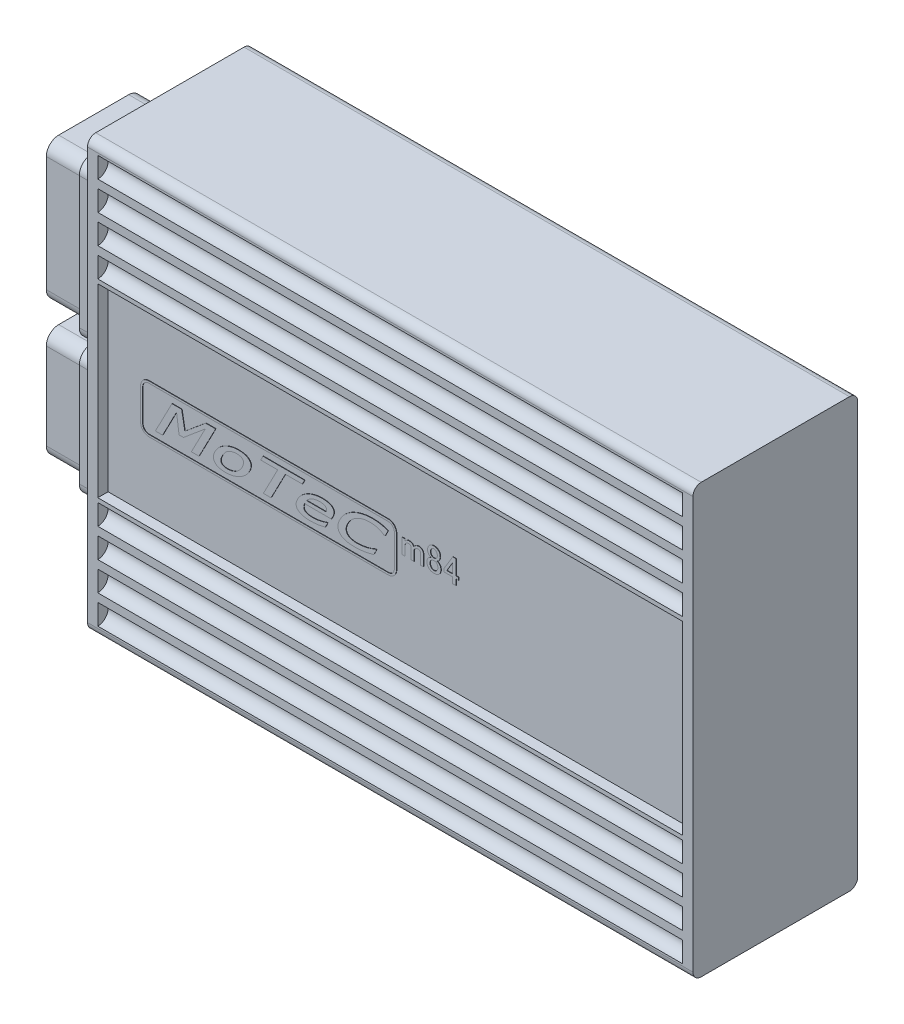
from build123d import *

# Parameters (mm, degrees)
SKETCH_1_W          = 147
SKETCH_1_H          = 104
EXTRUDE_1_DEPTH     = 40
FILLET_1_R          = 2
SKETCH_5_W          = 147
SKETCH_5_H          = 45
CUT_EXTRUDE_1_DEPTH = 2.5
CUT_EXTRUDE_2_DEPTH = 161.975153362
SKETCH_7_W          = 147
SKETCH_7_H          = 45
CUT_EXTRUDE_3_DEPTH = 2.5
EXTRUDE_4_DEPTH     = 2.5
EXTRUDE_5_DEPTH     = 2.5
EXTRUDE_6_DEPTH     = 0.1
EXTRUDE_7_DEPTH     = 0.1
SKETCH_13_W         = 27
SKETCH_13_H         = 38
SKETCH_13_H_2       = 31
EXTRUDE_8_DEPTH     = 8
SKETCH_14_W         = 23
SKETCH_14_H         = 34
SKETCH_14_H_2       = 27
EXTRUDE_9_DEPTH     = 10
FILLET_2_R          = 3
SKETCH_15_R         = 8.844335161
SKETCH_15_R_2       = 8.721679786
CUT_EXTRUDE_4_DEPTH = 1


with BuildPart() as part:
    # ｽｹｯﾁ1 → ﾎﾞｽ - 押し出し1 (new body)
    with BuildSketch(Plane.XY):
        Rectangle(SKETCH_1_W, SKETCH_1_H)
    extrude(amount=EXTRUDE_1_DEPTH)

    # ﾌｨﾚｯﾄ1
    fillet_1_edges = [part.edges().sort_by_distance(p)[0] for p in [
        (0, -52, 40),
        (0, -52, 0),
        (0, 52, 0),
        (0, 52, 40),
    ]]
    fillet(fillet_1_edges, radius=FILLET_1_R)

    # ｽｹｯﾁ5 → ｶｯﾄ - 押し出し1 (cut)
    with BuildSketch(Plane(origin=(0, 0, 0), x_dir=(-1, 0, 0), z_dir=(0, 0, -1))):
        Rectangle(SKETCH_5_W, SKETCH_5_H)
    extrude(amount=-CUT_EXTRUDE_1_DEPTH, mode=Mode.SUBTRACT)

    # ｽｹｯﾁ6 → ｶｯﾄ - 押し出し2 (cut, through all)
    with BuildSketch(Plane.ZY.offset(73.5)):
        with BuildLine():
            Line((0, 49.5), (0, 44.5))
            ThreePointArc((0, 44.5), (2.5, 47), (0, 49.5))
        make_face()
        with BuildLine():
            Line((0, 42.5), (0, 37.5))
            ThreePointArc((0, 37.5), (2.5, 40), (0, 42.5))
        make_face()
        with BuildLine():
            Line((0, 35.5), (0, 30.5))
            ThreePointArc((0, 30.5), (2.5, 33), (0, 35.5))
        make_face()
        with BuildLine():
            Line((0, 28.5), (0, 23.5))
            ThreePointArc((0, 23.5), (2.5, 26), (0, 28.5))
        make_face()
        with BuildLine():
            Line((40, 28.5), (40, 23.5))
            ThreePointArc((40, 23.5), (37.5, 26), (40, 28.5))
        make_face()
        with BuildLine():
            Line((40, 35.5), (40, 30.5))
            ThreePointArc((40, 30.5), (37.5, 33), (40, 35.5))
        make_face()
        with BuildLine():
            Line((40, 42.5), (40, 37.5))
            ThreePointArc((40, 37.5), (37.5, 40), (40, 42.5))
        make_face()
        with BuildLine():
            Line((40, 49.5), (40, 44.5))
            ThreePointArc((40, 44.5), (37.5, 47), (40, 49.5))
        make_face()
    cut_extrude_2 = extrude(amount=-CUT_EXTRUDE_2_DEPTH, mode=Mode.SUBTRACT)

    # ﾐﾗｰ1: ｶｯﾄ - 押し出し2 across plane
    add(cut_extrude_2.mirror(Plane.ZX), mode=Mode.SUBTRACT)

    # ｽｹｯﾁ7 → ｶｯﾄ - 押し出し3 (cut)
    with BuildSketch(Plane.XY.offset(40)):
        Rectangle(SKETCH_7_W, SKETCH_7_H)
    extrude(amount=-CUT_EXTRUDE_3_DEPTH, mode=Mode.SUBTRACT)

    # ｽｹｯﾁ8 → ﾎﾞｽ - 押し出し4 (add)
    with BuildSketch(Plane.ZY.offset(73.5)):
        with BuildLine():
            Line((2, -52), (38, -52))
            ThreePointArc((38, -52), (39.414213562, -51.414213562), (40, -50))
            Line((40, -50), (40, 50))
            ThreePointArc((40, 50), (39.414213562, 51.414213562), (38, 52))
            Line((38, 52), (2, 52))
            ThreePointArc((2, 52), (0.585786438, 51.414213562), (0, 50))
            Line((0, 50), (0, -50))
            ThreePointArc((0, -50), (0.585786438, -51.414213562), (2, -52))
        make_face()
    extrude(amount=-EXTRUDE_4_DEPTH)

    # ｽｹｯﾁ9 → ﾎﾞｽ - 押し出し5 (add)
    with BuildSketch(Plane(origin=(73.5, 0, 0), x_dir=(0, 0, -1), z_dir=(1, 0, 0))):
        with BuildLine():
            Line((-38, -52), (-2, -52))
            ThreePointArc((-2, -52), (-0.585786438, -51.414213562), (0, -50))
            Line((0, -50), (0, 50))
            ThreePointArc((0, 50), (-0.585786438, 51.414213562), (-2, 52))
            Line((-2, 52), (-38, 52))
            ThreePointArc((-38, 52), (-39.414213562, 51.414213562), (-40, 50))
            Line((-40, 50), (-40, -50))
            ThreePointArc((-40, -50), (-39.414213562, -51.414213562), (-38, -52))
        make_face()
    extrude(amount=-EXTRUDE_5_DEPTH)

    # ｽｹｯﾁ11 → ﾎﾞｽ - 押し出し6 (add)
    # profile 1 of 3: a face of its own
    with BuildSketch(Plane.XY.offset(37.5)):
        with BuildLine():
            Line((1.144144144, 0.098069498), (0.447971781, 0.098069498))
            Line((0.447971781, 0.098069498), (0.447971781, 3.759330759))
            Line((0.447971781, 3.759330759), (1.144144144, 3.759330759))
            Line((1.144144144, 3.759330759), (1.144144144, 3.203603604))
            add(Edge.make_bspline(
                [(1.144144144, 3.203603604), (1.209094475, 3.300576984), (1.316490685, 3.432401394), (1.476128806, 3.58323051), (1.598188132, 3.67094831), (1.723684656, 3.739797755), (1.896496282, 3.805448376), (2.033643976, 3.824764595), (2.124839125, 3.824710425)],
                knots=[0, 0, 0, 0, 0.289076243, 0.420055779, 0.543346146, 0.660648957, 0.774006625, 1, 1, 1, 1], degree=3))
            add(Edge.make_bspline(
                [(2.124839125, 3.824710425), (2.222453162, 3.825502434), (2.365318527, 3.815397975), (2.547538805, 3.781292301), (2.671391328, 3.746176063), (2.785948421, 3.70006945), (2.925267534, 3.624888497), (3.018307002, 3.552522146), (3.072844273, 3.497812098)],
                knots=[0, 0, 0, 0, 0.284349585, 0.416050932, 0.539630879, 0.658870528, 0.775162342, 1, 1, 1, 1], degree=3))
            add(Edge.make_bspline(
                [(3.072844273, 3.497812098), (3.125910433, 3.444067838), (3.2249881, 3.332056492), (3.300695747, 3.203147761), (3.334362934, 3.138223938)],
                knots=[0, 0, 0, 0, 0.508065967, 1, 1, 1, 1], degree=3))
            add(Edge.make_bspline(
                [(3.334362934, 3.138223938), (3.400916793, 3.246117725), (3.514183942, 3.39515933), (3.69458124, 3.559539674), (3.839074417, 3.655319927), (3.992148203, 3.731705924), (4.213801324, 3.806649249), (4.391790494, 3.823489453), (4.511196911, 3.824710425)],
                knots=[0, 0, 0, 0, 0.26615625, 0.390354004, 0.51067604, 0.62890337, 0.748675196, 1, 1, 1, 1], degree=3))
            add(Edge.make_bspline(
                [(4.511196911, 3.824710425), (4.593711478, 3.823900393), (4.714964686, 3.817132519), (4.870108538, 3.785588746), (4.976339715, 3.753121766), (5.075851443, 3.711588521), (5.198084993, 3.644276204), (5.279657693, 3.578954386), (5.328442728, 3.530501931)],
                knots=[0, 0, 0, 0, 0.277853537, 0.406705624, 0.531658906, 0.650907513, 0.768780622, 1, 1, 1, 1], degree=3))
            add(Edge.make_bspline(
                [(5.328442728, 3.530501931), (5.38029412, 3.478665866), (5.451324968, 3.396653054), (5.528818936, 3.278355141), (5.576015875, 3.189084536), (5.610296883, 3.097212137), (5.645373484, 2.97259854), (5.655816367, 2.875985595), (5.655341055, 2.811325611)],
                knots=[0, 0, 0, 0, 0.271080785, 0.399344613, 0.522112387, 0.643458092, 0.761078932, 1, 1, 1, 1], degree=3))
            Line((5.655341055, 2.811325611), (5.655341055, 0.098069498))
            Line((5.655341055, 0.098069498), (4.959168693, 0.098069498))
            Line((4.959168693, 0.098069498), (4.959168693, 2.680566281))
            add(Edge.make_bspline(
                [(4.959168693, 2.680566281), (4.957533627, 2.740900528), (4.948967941, 2.856801651), (4.900941368, 2.962851102), (4.870785071, 3.007464607)],
                knots=[0, 0, 0, 0, 0.52989765, 1, 1, 1, 1], degree=3))
            add(Edge.make_bspline(
                [(4.870785071, 3.007464607), (4.810022588, 3.068517718), (4.669054485, 3.172179641), (4.496902642, 3.203775177), (4.413127413, 3.203603604)],
                knots=[0, 0, 0, 0, 0.507505966, 1, 1, 1, 1], degree=3))
            add(Edge.make_bspline(
                [(4.413127413, 3.203603604), (4.339831937, 3.202789794), (4.231484319, 3.195531115), (4.092740614, 3.164650864), (3.996262969, 3.130974916), (3.903905229, 3.090652477), (3.78820347, 3.021145215), (3.708921056, 2.957782376), (3.661261261, 2.909395109)],
                knots=[0, 0, 0, 0, 0.265314778, 0.391024086, 0.512886475, 0.634416216, 0.754827548, 1, 1, 1, 1], degree=3))
            add(Edge.make_bspline(
                [(3.661261261, 2.909395109), (3.587585708, 2.832970405), (3.459302835, 2.687846458), (3.401078827, 2.502381341), (3.3997426, 2.419047619)],
                knots=[0, 0, 0, 0, 0.564258034, 1, 1, 1, 1], degree=3))
            Line((3.3997426, 2.419047619), (3.3997426, 0.098069498))
            Line((3.3997426, 0.098069498), (2.703570237, 0.098069498))
            Line((2.703570237, 0.098069498), (2.703570237, 2.647876448))
            add(Edge.make_bspline(
                [(2.703570237, 2.647876448), (2.704140297, 2.715262391), (2.672005479, 2.85675132), (2.597820466, 2.981137348), (2.54980695, 3.04015444)],
                knots=[0, 0, 0, 0, 0.46824483, 1, 1, 1, 1], degree=3))
            add(Edge.make_bspline(
                [(2.54980695, 3.04015444), (2.493149542, 3.098007569), (2.334298815, 3.183611446), (2.155918243, 3.205201222), (2.059459459, 3.203603604)],
                knots=[0, 0, 0, 0, 0.453090255, 1, 1, 1, 1], degree=3))
            add(Edge.make_bspline(
                [(2.059459459, 3.203603604), (1.944729086, 3.205380493), (1.713210608, 3.159757499), (1.519279466, 3.025504849), (1.438352638, 2.942084942)],
                knots=[0, 0, 0, 0, 0.496525804, 1, 1, 1, 1], degree=3))
            add(Edge.make_bspline(
                [(1.438352638, 2.942084942), (1.35447241, 2.856242051), (1.212714539, 2.690331933), (1.143236289, 2.48177415), (1.144144144, 2.386357786)],
                knots=[0, 0, 0, 0, 0.561835364, 1, 1, 1, 1], degree=3))
            Line((1.144144144, 2.386357786), (1.144144144, 0.098069498))
        make_face()
    # profile 2 of 3: a face of its own
    with BuildSketch(Plane.XY.offset(37.5)):
        with BuildLine():
            Line((8.965489299, 3.007464607), (8.965489299, 2.942084942))
            add(Edge.make_bspline(
                [(8.965489299, 2.942084942), (9.066135435, 2.919951937), (9.27023082, 2.836416684), (9.439678289, 2.695712893), (9.521216455, 2.615186615)],
                knots=[0, 0, 0, 0, 0.472373328, 1, 1, 1, 1], degree=3))
            add(Edge.make_bspline(
                [(9.521216455, 2.615186615), (9.585452655, 2.550762147), (9.6733995, 2.444937025), (9.76191299, 2.284723735), (9.818308984, 2.157849235), (9.860034277, 2.021864576), (9.903959162, 1.826621272), (9.912857116, 1.673056413), (9.913494447, 1.569111969)],
                knots=[0, 0, 0, 0, 0.238093942, 0.356647629, 0.47758062, 0.60036302, 0.727832734, 1, 1, 1, 1], degree=3))
            add(Edge.make_bspline(
                [(9.913494447, 1.569111969), (9.913786048, 1.46355969), (9.899227581, 1.307421444), (9.852036974, 1.106434786), (9.802098975, 0.963401973), (9.736512725, 0.826947911), (9.629417916, 0.651184491), (9.53064566, 0.530730209), (9.455836789, 0.457657658)],
                knots=[0, 0, 0, 0, 0.256257606, 0.379192059, 0.500730937, 0.623508935, 0.746243874, 1, 1, 1, 1], degree=3))
            add(Edge.make_bspline(
                [(9.455836789, 0.457657658), (9.383864278, 0.387220625), (9.263851695, 0.291320196), (9.081262489, 0.195153101), (8.931205386, 0.136211677), (8.769402856, 0.088125697), (8.529433762, 0.045329772), (8.342131055, 0.030730599), (8.213623147, 0.032689833)],
                knots=[0, 0, 0, 0, 0.224285237, 0.339223886, 0.458168827, 0.582682974, 0.714302543, 1, 1, 1, 1], degree=3))
            add(Edge.make_bspline(
                [(8.213623147, 0.032689833), (8.085115239, 0.030730599), (7.897812532, 0.045329772), (7.657843437, 0.088125697), (7.496040908, 0.136211677), (7.345983804, 0.195153101), (7.163394599, 0.291320196), (7.043382016, 0.387220625), (6.971409505, 0.457657658)],
                knots=[0, 0, 0, 0, 0.285697457, 0.417317026, 0.541831173, 0.660776114, 0.775714763, 1, 1, 1, 1], degree=3))
            add(Edge.make_bspline(
                [(6.971409505, 0.457657658), (6.896430141, 0.530653978), (6.798155259, 0.651330647), (6.690351192, 0.826589026), (6.626994804, 0.963996337), (6.574754581, 1.106119498), (6.528357976, 1.307549811), (6.51328421, 1.463493083), (6.513751847, 1.569111969)],
                knots=[0, 0, 0, 0, 0.253779418, 0.376525622, 0.498895351, 0.620773136, 0.743718873, 1, 1, 1, 1], degree=3))
            add(Edge.make_bspline(
                [(6.513751847, 1.569111969), (6.514389178, 1.673056413), (6.523287132, 1.826621272), (6.567212017, 2.021864576), (6.60893731, 2.157849235), (6.665333304, 2.284723735), (6.753846794, 2.444937025), (6.841793639, 2.550762147), (6.906029839, 2.615186615)],
                knots=[0, 0, 0, 0, 0.272167266, 0.39963698, 0.52241938, 0.643352371, 0.761906058, 1, 1, 1, 1], degree=3))
            add(Edge.make_bspline(
                [(6.906029839, 2.615186615), (6.987568005, 2.695712893), (7.157015473, 2.836416684), (7.361110858, 2.919951937), (7.461756995, 2.942084942)],
                knots=[0, 0, 0, 0, 0.527626672, 1, 1, 1, 1], degree=3))
            Line((7.461756995, 2.942084942), (7.461756995, 3.007464607))
            add(Edge.make_bspline(
                [(7.461756995, 3.007464607), (7.387744142, 3.03094171), (7.236053687, 3.118292426), (7.105188692, 3.23352326), (7.03678917, 3.301673102)],
                knots=[0, 0, 0, 0, 0.444019688, 1, 1, 1, 1], degree=3))
            add(Edge.make_bspline(
                [(7.03678917, 3.301673102), (6.977518997, 3.35903046), (6.899662198, 3.454339857), (6.816093373, 3.593494288), (6.764652133, 3.701531415), (6.726085184, 3.815029485), (6.688063226, 3.975123666), (6.677701886, 4.09996308), (6.677201011, 4.184298584)],
                knots=[0, 0, 0, 0, 0.252388127, 0.374950703, 0.496630733, 0.618235357, 0.741494458, 1, 1, 1, 1], degree=3))
            add(Edge.make_bspline(
                [(6.677201011, 4.184298584), (6.676788162, 4.299513212), (6.691239733, 4.468775711), (6.738116282, 4.686684342), (6.789602145, 4.838044846), (6.853929919, 4.982268437), (6.959522519, 5.16413109), (7.05983462, 5.286997589), (7.134858668, 5.361132561)],
                knots=[0, 0, 0, 0, 0.266281071, 0.391515052, 0.514598345, 0.63533766, 0.756206788, 1, 1, 1, 1], degree=3))
            add(Edge.make_bspline(
                [(7.134858668, 5.361132561), (7.200211428, 5.425268726), (7.30730912, 5.513878349), (7.470524842, 5.602074303), (7.601082347, 5.658438456), (7.741930041, 5.700087781), (7.945320215, 5.743870165), (8.105241661, 5.752847284), (8.213623147, 5.753410553)],
                knots=[0, 0, 0, 0, 0.23339933, 0.350616063, 0.471182202, 0.594644589, 0.723765921, 1, 1, 1, 1], degree=3))
            add(Edge.make_bspline(
                [(8.213623147, 5.753410553), (8.323233931, 5.755112588), (8.48410633, 5.740416863), (8.691239122, 5.697387161), (8.834442306, 5.649365619), (8.970079151, 5.589872982), (9.141204679, 5.492779169), (9.254873969, 5.397392466), (9.325077458, 5.328442728)],
                knots=[0, 0, 0, 0, 0.268572808, 0.395225723, 0.51830846, 0.638475842, 0.758246691, 1, 1, 1, 1], degree=3))
            add(Edge.make_bspline(
                [(9.325077458, 5.328442728), (9.39418836, 5.257454785), (9.489224205, 5.142369257), (9.587427387, 4.968978387), (9.645880312, 4.829182396), (9.694048753, 4.68123385), (9.737365049, 4.466040863), (9.751796352, 4.298723305), (9.750045283, 4.184298584)],
                knots=[0, 0, 0, 0, 0.237237054, 0.354867339, 0.475588846, 0.599282908, 0.726563048, 1, 1, 1, 1], degree=3))
            add(Edge.make_bspline(
                [(9.750045283, 4.184298584), (9.74955551, 4.094804049), (9.739885167, 3.96123048), (9.696079163, 3.790830625), (9.654422111, 3.668504224), (9.597576308, 3.552468455), (9.508437451, 3.400715898), (9.420381221, 3.299951892), (9.357767291, 3.236293436)],
                knots=[0, 0, 0, 0, 0.255143643, 0.378267329, 0.499952309, 0.622215881, 0.745323495, 1, 1, 1, 1], degree=3))
            add(Edge.make_bspline(
                [(9.357767291, 3.236293436), (9.303144089, 3.184136782), (9.1835047, 3.085887304), (9.039239837, 3.029434866), (8.965489299, 3.007464607)],
                knots=[0, 0, 0, 0, 0.495336252, 1, 1, 1, 1], degree=3))
        make_face()
        with BuildLine():
            add(Edge.make_bspline(
                [(8.213623147, 5.164993565), (8.110867842, 5.164521396), (7.902597168, 5.130227617), (7.730163677, 5.008392673), (7.657895991, 4.936164736)],
                knots=[0, 0, 0, 0, 0.501620805, 1, 1, 1, 1], degree=3))
            add(Edge.make_bspline(
                [(7.657895991, 4.936164736), (7.612808635, 4.893560551), (7.557725294, 4.817587027), (7.49589241, 4.707898191), (7.459876828, 4.616407695), (7.430321328, 4.518987394), (7.405393845, 4.374142701), (7.394301605, 4.261879997), (7.39637733, 4.184298584)],
                knots=[0, 0, 0, 0, 0.226301537, 0.34299475, 0.461284975, 0.586435464, 0.716022688, 1, 1, 1, 1], degree=3))
            add(Edge.make_bspline(
                [(7.39637733, 4.184298584), (7.394045852, 4.111473652), (7.405887536, 4.005797818), (7.430016881, 3.869220684), (7.460596729, 3.776587561), (7.495856135, 3.688474606), (7.558042733, 3.581346623), (7.613986156, 3.507790863), (7.657895991, 3.465122265)],
                knots=[0, 0, 0, 0, 0.276895612, 0.405600582, 0.52837923, 0.648539863, 0.767199981, 1, 1, 1, 1], degree=3))
            add(Edge.make_bspline(
                [(7.657895991, 3.465122265), (7.728278551, 3.393840982), (7.889922669, 3.275872131), (8.086037652, 3.236181018), (8.180933314, 3.236293436)],
                knots=[0, 0, 0, 0, 0.514332654, 1, 1, 1, 1], degree=3))
            add(Edge.make_bspline(
                [(8.180933314, 3.236293436), (8.296842029, 3.235588362), (8.511158166, 3.259952083), (8.701882786, 3.362895066), (8.769350303, 3.432432432)],
                knots=[0, 0, 0, 0, 0.548332788, 1, 1, 1, 1], degree=3))
            add(Edge.make_bspline(
                [(8.769350303, 3.432432432), (8.813378155, 3.475979123), (8.871724326, 3.549944449), (8.930988181, 3.661115321), (8.967607122, 3.752101519), (8.99642492, 3.849788595), (9.024738233, 3.994040256), (9.031056052, 4.107031508), (9.030868964, 4.184298584)],
                knots=[0, 0, 0, 0, 0.227087098, 0.343044258, 0.461305242, 0.586424794, 0.716259043, 1, 1, 1, 1], degree=3))
            add(Edge.make_bspline(
                [(9.030868964, 4.184298584), (9.031056052, 4.26156566), (9.024738233, 4.374556912), (8.99642492, 4.518808574), (8.967607122, 4.61649565), (8.930988181, 4.707481847), (8.871724326, 4.818652719), (8.813378155, 4.892618046), (8.769350303, 4.936164736)],
                knots=[0, 0, 0, 0, 0.283740957, 0.413575206, 0.538694758, 0.656955742, 0.772912902, 1, 1, 1, 1], degree=3))
            add(Edge.make_bspline(
                [(8.769350303, 4.936164736), (8.697082617, 5.008392673), (8.524649126, 5.130227617), (8.316378452, 5.164521396), (8.213623147, 5.164993565)],
                knots=[0, 0, 0, 0, 0.498379195, 1, 1, 1, 1], degree=3))
        make_face(mode=Mode.SUBTRACT)
        with BuildLine():
            add(Edge.make_bspline(
                [(8.213623147, 2.680566281), (8.145962429, 2.681046709), (8.046278765, 2.673920041), (7.918540086, 2.646066966), (7.829961199, 2.616636254), (7.745712521, 2.580447266), (7.640074156, 2.520541136), (7.569862076, 2.46197437), (7.52713666, 2.419047619)],
                knots=[0, 0, 0, 0, 0.268893381, 0.395354554, 0.518591747, 0.639255943, 0.759203962, 1, 1, 1, 1], degree=3))
            add(Edge.make_bspline(
                [(7.52713666, 2.419047619), (7.482049304, 2.376443434), (7.426965963, 2.30046991), (7.365133079, 2.190781074), (7.329117498, 2.099290578), (7.299561997, 2.001870277), (7.274634514, 1.857025584), (7.263542274, 1.74476288), (7.265617999, 1.667181467)],
                knots=[0, 0, 0, 0, 0.226301537, 0.34299475, 0.461284975, 0.586435464, 0.716022688, 1, 1, 1, 1], degree=3))
            add(Edge.make_bspline(
                [(7.265617999, 1.667181467), (7.266126561, 1.58942892), (7.273747169, 1.474753095), (7.304399928, 1.327863505), (7.338042898, 1.226504419), (7.378246889, 1.130434986), (7.447817671, 1.011927586), (7.51021042, 0.930167129), (7.559826493, 0.882625483)],
                knots=[0, 0, 0, 0, 0.27113284, 0.399160129, 0.521947986, 0.642941682, 0.761423011, 1, 1, 1, 1], degree=3))
            add(Edge.make_bspline(
                [(7.559826493, 0.882625483), (7.601358672, 0.838829149), (7.672649282, 0.784676366), (7.772977226, 0.720832087), (7.853909294, 0.685561209), (7.937613727, 0.655060765), (8.058031115, 0.63097718), (8.15040425, 0.618838179), (8.213623147, 0.621106821)],
                knots=[0, 0, 0, 0, 0.248910688, 0.370594491, 0.491909555, 0.614155835, 0.739210138, 1, 1, 1, 1], degree=3))
            add(Edge.make_bspline(
                [(8.213623147, 0.621106821), (8.276842044, 0.618838179), (8.369215179, 0.63097718), (8.489632567, 0.655060765), (8.573337, 0.685561209), (8.654269068, 0.720832087), (8.754597012, 0.784676366), (8.825887622, 0.838829149), (8.867419801, 0.882625483)],
                knots=[0, 0, 0, 0, 0.260789862, 0.385844165, 0.508090445, 0.629405509, 0.751089312, 1, 1, 1, 1], degree=3))
            add(Edge.make_bspline(
                [(8.867419801, 0.882625483), (8.917035874, 0.930167129), (8.979428623, 1.011927586), (9.048999405, 1.130434986), (9.089203396, 1.226504419), (9.122846366, 1.327863505), (9.153499125, 1.474753095), (9.161119733, 1.58942892), (9.161628295, 1.667181467)],
                knots=[0, 0, 0, 0, 0.238576989, 0.357058318, 0.478052014, 0.600839871, 0.72886716, 1, 1, 1, 1], degree=3))
            add(Edge.make_bspline(
                [(9.161628295, 1.667181467), (9.161043884, 1.744907586), (9.153640483, 1.859659093), (9.122570958, 2.006807567), (9.089760557, 2.108475702), (9.048637066, 2.204176326), (8.979545266, 2.322483241), (8.916977183, 2.404171707), (8.867419801, 2.451737452)],
                knots=[0, 0, 0, 0, 0.271119923, 0.399141112, 0.523261622, 0.642958694, 0.761434378, 1, 1, 1, 1], degree=3))
            add(Edge.make_bspline(
                [(8.867419801, 2.451737452), (8.828359871, 2.488890771), (8.765094609, 2.541778648), (8.667480999, 2.591980355), (8.589286433, 2.626404048), (8.503274329, 2.648897037), (8.378417136, 2.674757886), (8.280335053, 2.680293399), (8.213623147, 2.680566281)],
                knots=[0, 0, 0, 0, 0.228211045, 0.343996016, 0.462270739, 0.587868715, 0.718101765, 1, 1, 1, 1], degree=3))
        make_face(mode=Mode.SUBTRACT)
    # profile 3 of 3: a face of its own
    with BuildSketch(Plane.XY.offset(37.5)):
        Polygon((12.790199724, 5.753410553), (13.542065875, 5.753410553), (13.542065875, 2.157528958), (14.228552362, 2.157528958), (14.228552362, 1.538843606), (13.542065875, 1.538843606), (13.542065875, 0.098069498), (12.768406502, 0.098069498), (12.768406502, 1.538843606), (10.599980933, 1.538843606), (10.599980933, 2.19021879), align=None)
        Polygon((12.768406502, 4.543886744), (11.319157252, 2.157528958), (12.768406502, 2.157528958), align=None, mode=Mode.SUBTRACT)
    extrude(amount=EXTRUDE_6_DEPTH)

    # ｽｹｯﾁ10 → ﾎﾞｽ - 押し出し7 (add)
    # profile 1 of 6: a face of its own
    with BuildSketch(Plane.XY.offset(37.5)):
        with BuildLine():
            Line((-61, 5.88), (-2.9, 5.88))
            ThreePointArc((-2.9, 5.88), (-1.485786438, 5.294213562), (-0.9, 3.88))
            Line((-0.9, 3.88), (-0.9, -3.88))
            ThreePointArc((-0.9, -3.88), (-1.485786438, -5.294213562), (-2.9, -5.88))
            Line((-2.9, -5.88), (-61, -5.88))
            ThreePointArc((-61, -5.88), (-62.414213562, -5.294213562), (-63, -3.88))
            Line((-63, -3.88), (-63, 3.88))
            ThreePointArc((-63, 3.88), (-62.414213562, 5.294213562), (-61, 5.88))
        make_face()
        with BuildLine():
            ThreePointArc((-61, 5.38), (-62.060660172, 4.940660172), (-62.5, 3.88))
            Line((-62.5, 3.88), (-62.5, -3.88))
            ThreePointArc((-62.5, -3.88), (-62.060660172, -4.940660172), (-61, -5.38))
            Line((-61, -5.38), (-2.9, -5.38))
            ThreePointArc((-2.9, -5.38), (-1.839339828, -4.940660172), (-1.4, -3.88))
            Line((-1.4, -3.88), (-1.4, 3.88))
            ThreePointArc((-1.4, 3.88), (-1.839339828, 4.940660172), (-2.9, 5.38))
            Line((-2.9, 5.38), (-61, 5.38))
        make_face(mode=Mode.SUBTRACT)
    # profile 2 of 6: a face of its own
    with BuildSketch(Plane.XY.offset(37.5)):
        with BuildLine():
            add(Edge.make_bspline(
                [(-10.448395745, -2.995822785), (-10.079179397, -2.996187373), (-9.525773747, -2.964212634), (-8.792674877, -2.86404899), (-8.243971261, -2.757517863), (-7.693297667, -2.620866814), (-6.948198135, -2.388578016), (-6.394778587, -2.177088425), (-6.030579729, -2.013403657)],
                knots=[0, 0, 0, 0, 0.242890256, 0.364218788, 0.486644916, 0.610525481, 0.737368127, 1, 1, 1, 1], degree=3))
            Line((-6.030579729, -2.013403657), (-5.700548303, -2.013403657))
            Line((-5.700548303, -2.013403657), (-6.394381813, -3.345809599))
            add(Edge.make_bspline(
                [(-6.394381813, -3.345809599), (-6.590242705, -3.397384232), (-6.87018769, -3.461750188), (-7.21853057, -3.555205198), (-7.442685771, -3.612850905), (-7.666129645, -3.670455885), (-8.016552606, -3.747591738), (-8.296305269, -3.804126621), (-8.494302699, -3.841624253)],
                knots=[0, 0, 0, 0, 0.281526267, 0.399181891, 0.50130773, 0.603257568, 0.719902735, 1, 1, 1, 1], degree=3))
            add(Edge.make_bspline(
                [(-8.494302699, -3.841624253), (-8.867616552, -3.907674957), (-9.344445406, -3.980351143), (-9.929627045, -4.040231597), (-10.361966942, -4.069046298), (-10.692400046, -4.075561986), (-10.916579861, -4.076483826)],
                knots=[0, 0, 0, 0, 0.46673198, 0.593333163, 0.724012956, 1, 1, 1, 1], degree=3))
            add(Edge.make_bspline(
                [(-10.916579861, -4.076483826), (-11.122414491, -4.078535393), (-11.425534132, -4.068608701), (-11.822058047, -4.044433816), (-12.102648038, -4.018677117), (-12.371739163, -3.984191548), (-12.63019263, -3.945698575), (-12.877078513, -3.895367156), (-13.113745668, -3.841559295), (-13.337518105, -3.776982337), (-13.548941178, -3.704344018), (-13.748449834, -3.625521713), (-13.934882104, -3.536653533), (-14.107299412, -3.43715888), (-14.320305345, -3.299331199), (-14.463169981, -3.176704099), (-14.551530635, -3.090994638)],
                knots=[0, 0, 0, 0, 0.16014093, 0.235947779, 0.309130297, 0.379362033, 0.447054338, 0.512416962, 0.575391442, 0.635884882, 0.693557866, 0.749310158, 0.802740376, 0.854105346, 0.904134877, 1, 1, 1, 1], degree=3))
            add(Edge.make_bspline(
                [(-14.551530635, -3.090994638), (-14.633217917, -3.008069116), (-14.745140542, -2.874676948), (-14.866480132, -2.677487152), (-14.939228115, -2.520302236), (-14.999759436, -2.355726031), (-15.0444953, -2.182448701), (-15.072885482, -2.000438121), (-15.088767489, -1.810092976), (-15.087181611, -1.611230376), (-15.066124716, -1.404501519), (-15.029292384, -1.190087105), (-14.974827537, -0.967548374), (-14.902804451, -0.737749201), (-14.776669109, -0.412979257), (-14.663666464, -0.169940532), (-14.579161173, -0.007119594)],
                knots=[0, 0, 0, 0, 0.105346759, 0.156890264, 0.209093138, 0.261831399, 0.315406748, 0.370753984, 0.4283623, 0.488101386, 0.55044541, 0.616222302, 0.684847226, 0.757639184, 0.834008045, 1, 1, 1, 1], degree=3))
            add(Edge.make_bspline(
                [(-14.579161173, -0.007119594), (-14.495094558, 0.154901889), (-14.358127816, 0.391745943), (-14.156906957, 0.695436636), (-13.997291588, 0.917191818), (-13.826514111, 1.131700419), (-13.647310786, 1.340595885), (-13.457758735, 1.542354233), (-13.19132728, 1.802228023), (-12.83619764, 2.109922673), (-12.225445347, 2.569916397), (-11.723916276, 2.858626435), (-11.378623857, 3.033774613)],
                knots=[0, 0, 0, 0, 0.121977628, 0.182680008, 0.243424758, 0.304523679, 0.365874737, 0.427325789, 0.489476058, 0.614555059, 0.741086083, 1, 1, 1, 1], degree=3))
            add(Edge.make_bspline(
                [(-11.378623857, 3.033774613), (-11.033615813, 3.204914177), (-10.495976163, 3.434259642), (-9.745309965, 3.668048122), (-9.156733015, 3.817363836), (-8.550664434, 3.932456099), (-7.720378104, 4.047670091), (-7.088270185, 4.075839827), (-6.664547073, 4.077594937)],
                knots=[0, 0, 0, 0, 0.237239243, 0.359144459, 0.483967525, 0.611048753, 0.738923559, 1, 1, 1, 1], degree=3))
            add(Edge.make_bspline(
                [(-6.664547073, 4.077594937), (-6.352067232, 4.078369967), (-5.888251071, 4.059286795), (-5.27926166, 3.995027295), (-4.831610234, 3.929170846), (-4.377415771, 3.835537654), (-3.727646597, 3.663247848), (-3.237244569, 3.490019419), (-2.905258878, 3.359200949)],
                knots=[0, 0, 0, 0, 0.243327498, 0.36112692, 0.476764065, 0.595548033, 0.722064397, 1, 1, 1, 1], degree=3))
            Line((-2.905258878, 3.359200949), (-3.605232507, 2.014514768))
            Line((-3.605232507, 2.014514768), (-3.947544172, 2.014514768))
            add(Edge.make_bspline(
                [(-3.947544172, 2.014514768), (-4.177146226, 2.183957615), (-4.541564234, 2.408397331), (-5.061369354, 2.638192321), (-5.467852611, 2.7720783), (-5.896720071, 2.874010356), (-6.523243469, 2.970775053), (-7.011661092, 2.999053975), (-7.346100343, 2.996933896)],
                knots=[0, 0, 0, 0, 0.237578322, 0.354907119, 0.472535721, 0.593451409, 0.721574043, 1, 1, 1, 1], degree=3))
            add(Edge.make_bspline(
                [(-7.346100343, 2.996933896), (-7.621949045, 2.997863328), (-8.031099915, 2.975468234), (-8.566452662, 2.901599421), (-8.954218141, 2.823209106), (-9.336820976, 2.718470985), (-9.85530051, 2.545688741), (-10.231849012, 2.367986983), (-10.482166403, 2.241699191)],
                knots=[0, 0, 0, 0, 0.253905673, 0.376619063, 0.497273574, 0.617832409, 0.741623353, 1, 1, 1, 1], degree=3))
            add(Edge.make_bspline(
                [(-10.482166403, 2.241699191), (-10.704493449, 2.126068975), (-11.027950501, 1.922713913), (-11.431738386, 1.602530666), (-11.729562315, 1.333163989), (-12.011448852, 1.036529209), (-12.362096425, 0.600626761), (-12.584459411, 0.240209168), (-12.715634889, -0.011724684)],
                knots=[0, 0, 0, 0, 0.233293165, 0.354755673, 0.479581918, 0.607001034, 0.735457672, 1, 1, 1, 1], degree=3))
            add(Edge.make_bspline(
                [(-12.715634889, -0.011724684), (-12.781690035, -0.139091602), (-12.872512488, -0.32742162), (-12.967173228, -0.580347996), (-13.025682692, -0.755333013), (-13.066511139, -0.92392189), (-13.095085647, -1.084859906), (-13.109216377, -1.237905544), (-13.109162008, -1.427310302), (-13.0816473, -1.645156811), (-13.00274303, -1.955394951), (-12.886289155, -2.158190153), (-12.786246264, -2.268218618)],
                knots=[0, 0, 0, 0, 0.179368759, 0.260703803, 0.337327084, 0.409738049, 0.477214235, 0.541403107, 0.601497754, 0.713544005, 0.814808748, 1, 1, 1, 1], degree=3))
            add(Edge.make_bspline(
                [(-12.786246264, -2.268218618), (-12.666069261, -2.398894104), (-12.449610694, -2.567287825), (-12.114849289, -2.732454528), (-11.828540344, -2.830458849), (-11.515674278, -2.90451293), (-11.054502483, -2.977248061), (-10.694489656, -2.995954748), (-10.448395745, -2.995822785)],
                knots=[0, 0, 0, 0, 0.211162598, 0.323577214, 0.443787782, 0.571197435, 0.706507481, 1, 1, 1, 1], degree=3))
        make_face()
    # profile 3 of 6: a face of its own
    with BuildSketch(Plane.XY.offset(37.5)):
        with BuildLine():
            add(Edge.make_bspline(
                [(-18.889525097, 2.210998594), (-18.60477977, 2.209924417), (-18.194297659, 2.195670597), (-17.675862792, 2.119141938), (-17.341652967, 2.043833874), (-17.044484812, 1.946111999), (-16.784301239, 1.827264326), (-16.560837469, 1.685444412), (-16.376296559, 1.520729917), (-16.230721821, 1.335897955), (-16.125342258, 1.132374051), (-16.061965997, 0.911251376), (-16.04094831, 0.673378747), (-16.063787098, 0.420539935), (-16.147079479, 0.042704972), (-16.270496521, -0.236140982), (-16.367470992, -0.423112693)],
                knots=[0, 0, 0, 0, 0.180061578, 0.258846571, 0.330845668, 0.396281307, 0.45616824, 0.511145229, 0.562886747, 0.611717904, 0.659003582, 0.706790651, 0.756143512, 0.809012237, 0.866596122, 1, 1, 1, 1], degree=3))
            Line((-16.367470992, -0.423112693), (-16.683687148, -1.030984529))
            Line((-16.683687148, -1.030984529), (-23.167653393, -1.030984529))
            add(Edge.make_bspline(
                [(-23.167653393, -1.030984529), (-23.239045695, -1.170750272), (-23.32727788, -1.383767298), (-23.380041029, -1.675602888), (-23.383605189, -1.877861747), (-23.355841861, -2.064018905), (-23.289796671, -2.283535522), (-23.191587723, -2.421304905), (-23.112392317, -2.493868012)],
                knots=[0, 0, 0, 0, 0.300431922, 0.436418863, 0.564514619, 0.685087292, 0.794857444, 1, 1, 1, 1], degree=3))
            add(Edge.make_bspline(
                [(-23.112392317, -2.493868012), (-23.017106051, -2.585340569), (-22.847226727, -2.697817011), (-22.59319373, -2.813353247), (-22.3737017, -2.881025083), (-22.131137251, -2.932772502), (-21.761677101, -2.982250531), (-21.471300793, -2.996426876), (-21.270356452, -2.995822785)],
                knots=[0, 0, 0, 0, 0.202000042, 0.310704826, 0.427794016, 0.554063925, 0.691352201, 1, 1, 1, 1], degree=3))
            add(Edge.make_bspline(
                [(-21.270356452, -2.995822785), (-20.964540971, -2.996351585), (-20.496588285, -2.965119075), (-19.865715762, -2.869739864), (-19.457827855, -2.786959558), (-19.13346856, -2.712432469), (-18.904038649, -2.653717157), (-18.689552245, -2.596750102), (-18.490382219, -2.54135477), (-18.30748619, -2.481383404), (-18.09166102, -2.411253056), (-17.941072152, -2.348400585), (-17.845704773, -2.308129395)],
                knots=[0, 0, 0, 0, 0.261144907, 0.399927876, 0.544803449, 0.616587433, 0.684225858, 0.747100479, 0.806182116, 0.860786439, 0.911516199, 1, 1, 1, 1], degree=3))
            Line((-17.845704773, -2.308129395), (-17.544838915, -2.308129395))
            Line((-17.544838915, -2.308129395), (-18.151175721, -3.47168205))
            add(Edge.make_bspline(
                [(-18.151175721, -3.47168205), (-18.474999785, -3.5471826), (-18.951589617, -3.651250315), (-19.575822922, -3.771291324), (-20.016721088, -3.846359712), (-20.449119971, -3.906190322), (-21.027155845, -3.960643597), (-21.463383081, -3.980262515), (-21.755425897, -3.978241913)],
                knots=[0, 0, 0, 0, 0.273424221, 0.40108227, 0.522686273, 0.641160734, 0.759937403, 1, 1, 1, 1], degree=3))
            add(Edge.make_bspline(
                [(-21.755425897, -3.978241913), (-21.932522026, -3.978175739), (-22.192706898, -3.972760963), (-22.531903598, -3.952043353), (-22.770440248, -3.930529972), (-22.998323927, -3.903386067), (-23.215849336, -3.869236355), (-23.423052497, -3.830301416), (-23.618842141, -3.782149459), (-23.804424163, -3.730137152), (-23.979235015, -3.672079096), (-24.143831149, -3.607751008), (-24.297600649, -3.53705869), (-24.44133878, -3.460737231), (-24.57280593, -3.375764808), (-24.69508446, -3.286983048), (-24.805898904, -3.191427097), (-24.905737858, -3.09091846), (-24.992628074, -2.983954313), (-25.066804499, -2.871394669), (-25.128207709, -2.752932459), (-25.177473233, -2.629530851), (-25.21516928, -2.501205556), (-25.237438823, -2.367207206), (-25.248277149, -2.228006783), (-25.246452958, -2.083691882), (-25.232289622, -1.933856468), (-25.205890564, -1.778990483), (-25.167662563, -1.61875098), (-25.114349333, -1.454135143), (-25.025860829, -1.220649575), (-24.944424289, -1.04629545), (-24.883816807, -0.929672556)],
                knots=[0, 0, 0, 0, 0.093747242, 0.137709112, 0.179862389, 0.220513058, 0.259165551, 0.296402809, 0.332074397, 0.365856313, 0.398403907, 0.429537986, 0.459351621, 0.48795078, 0.515600453, 0.54214553, 0.567880939, 0.592971147, 0.617040608, 0.640704323, 0.664206276, 0.687543773, 0.710945624, 0.734857602, 0.759308086, 0.784769806, 0.811155493, 0.838896552, 0.867867806, 0.898277128, 0.93042215, 1, 1, 1, 1], degree=3))
            add(Edge.make_bspline(
                [(-24.883816807, -0.929672556), (-24.759634503, -0.688909353), (-24.540039842, -0.345081186), (-24.196678786, 0.07791408), (-23.908400728, 0.373992337), (-23.593088004, 0.651796367), (-23.250662832, 0.911377369), (-22.879017719, 1.150739802), (-22.483204579, 1.370818459), (-22.068266768, 1.566670414), (-21.641635427, 1.739712522), (-21.20594883, 1.885666555), (-20.760110282, 2.003549414), (-20.305801992, 2.097948472), (-19.682522184, 2.186328761), (-19.20779747, 2.209326191), (-18.889525097, 2.210998594)],
                knots=[0, 0, 0, 0, 0.114335128, 0.171789617, 0.229874067, 0.288677131, 0.349154139, 0.411204677, 0.475255755, 0.540322812, 0.604902689, 0.669629971, 0.734273837, 0.799595995, 0.865528919, 1, 1, 1, 1], degree=3))
        make_face()
        with BuildLine():
            add(Edge.make_bspline(
                [(-19.511212201, 1.228579466), (-19.690123559, 1.229647577), (-19.955060515, 1.215800602), (-20.30236549, 1.172977788), (-20.551890039, 1.126925621), (-20.794153599, 1.068104309), (-21.028891884, 0.998421774), (-21.255862333, 0.913254147), (-21.473046179, 0.815487601), (-21.679629663, 0.709737827), (-21.872423429, 0.599933656), (-22.050252038, 0.48635943), (-22.211346336, 0.367340293), (-22.35971273, 0.247314558), (-22.530565475, 0.081324228), (-22.643567995, -0.052034719), (-22.707144427, -0.146807314)],
                knots=[0, 0, 0, 0, 0.148912671, 0.220619962, 0.291229188, 0.360047186, 0.428112038, 0.494978369, 0.5617238, 0.626314759, 0.688140483, 0.746400746, 0.801873038, 0.854839704, 0.905156336, 1, 1, 1, 1], degree=3))
            Line((-22.707144427, -0.146807314), (-17.991532613, -0.146807314))
            add(Edge.make_bspline(
                [(-17.991532613, -0.146807314), (-17.946100069, -0.055525731), (-17.886471474, 0.081520823), (-17.852723149, 0.269192994), (-17.844697683, 0.397479407), (-17.86067105, 0.519571647), (-17.896378049, 0.63491486), (-17.952522645, 0.743416021), (-18.02883297, 0.845104429), (-18.129205545, 0.936459845), (-18.253370059, 1.016804602), (-18.40337976, 1.081369255), (-18.576292006, 1.137379193), (-18.775327106, 1.176555571), (-19.088500591, 1.2199414), (-19.337647477, 1.228096383), (-19.511212201, 1.228579466)],
                knots=[0, 0, 0, 0, 0.116957008, 0.168661705, 0.21723188, 0.263196383, 0.308490764, 0.354499842, 0.402078648, 0.452957402, 0.508727826, 0.570212028, 0.638975194, 0.716010132, 0.801565692, 1, 1, 1, 1], degree=3))
        make_face(mode=Mode.SUBTRACT)
    # profile 4 of 6: a face of its own
    with BuildSketch(Plane.XY.offset(37.5)):
        Polygon((-23.166118363, 3.881111111), (-23.727939302, 2.80045007), (-27.85409964, 2.80045007), (-31.330942335, -3.88), (-33.197538678, -3.88), (-29.720695983, 2.80045007), (-33.84685632, 2.80045007), (-33.285035382, 3.881111111), align=None)
    # profile 5 of 6: a face of its own
    with BuildSketch(Plane.XY.offset(37.5)):
        with BuildLine():
            add(Edge.make_bspline(
                [(-39.159594761, 2.210998594), (-39.00546659, 2.211988768), (-38.778481568, 2.204438716), (-38.482847085, 2.181673885), (-38.275304686, 2.159404462), (-38.077803336, 2.128014625), (-37.889780953, 2.091685181), (-37.710733433, 2.049097058), (-37.541919518, 1.997994019), (-37.381615208, 1.941757694), (-37.231500031, 1.877356965), (-37.091168485, 1.806370061), (-36.959786995, 1.729873127), (-36.838660089, 1.645038662), (-36.72625911, 1.554886392), (-36.623965297, 1.457387415), (-36.532496973, 1.353310663), (-36.450095106, 1.243925211), (-36.380261317, 1.128772568), (-36.319212031, 1.010316665), (-36.271874959, 0.886544043), (-36.234947043, 0.758687568), (-36.208482907, 0.626771788), (-36.195213279, 0.490043445), (-36.191728476, 0.348874175), (-36.201665726, 0.203177602), (-36.221723951, 0.053449253), (-36.253119823, -0.100704773), (-36.29382183, -0.259979352), (-36.348751567, -0.422942833), (-36.436396353, -0.652167339), (-36.519112652, -0.821594549), (-36.57767449, -0.935812676)],
                knots=[0, 0, 0, 0, 0.08746858, 0.128831776, 0.168279756, 0.205904567, 0.242299888, 0.276956138, 0.310308955, 0.342367171, 0.373331995, 0.402944872, 0.431584765, 0.459540617, 0.486799907, 0.513298249, 0.53963536, 0.565366642, 0.590918654, 0.615985791, 0.640902747, 0.665995106, 0.691454527, 0.717144802, 0.743869758, 0.771514635, 0.799937247, 0.829554397, 0.860759351, 0.893178606, 0.927103098, 1, 1, 1, 1], degree=3))
            add(Edge.make_bspline(
                [(-36.57767449, -0.935812676), (-36.700871405, -1.172950174), (-36.915233448, -1.513455133), (-37.251344422, -1.931715888), (-37.530165515, -2.227803741), (-37.837207445, -2.504077884), (-38.169271725, -2.764025707), (-38.528306158, -3.005714167), (-38.912177978, -3.226284938), (-39.313191436, -3.426468773), (-39.72770499, -3.601254706), (-40.153616941, -3.7457409), (-40.588713856, -3.868434952), (-41.034925672, -3.961894975), (-41.648991068, -4.050011322), (-42.117441186, -4.076242715), (-42.432278481, -4.076483826)],
                knots=[0, 0, 0, 0, 0.114859932, 0.17245018, 0.230506329, 0.28954477, 0.349887316, 0.411704423, 0.475482654, 0.540129373, 0.604325221, 0.668755915, 0.733402635, 0.798605219, 0.864633011, 1, 1, 1, 1], degree=3))
            add(Edge.make_bspline(
                [(-42.432278481, -4.076483826), (-42.583409613, -4.078335973), (-42.805554562, -4.068322198), (-43.095325788, -4.049410079), (-43.298475368, -4.025588007), (-43.492271074, -3.997294307), (-43.676493506, -3.96001046), (-43.851756425, -3.917358924), (-44.01768721, -3.868079316), (-44.17462678, -3.813815414), (-44.321076555, -3.749668229), (-44.45907122, -3.68166339), (-44.587023892, -3.605785504), (-44.706179982, -3.524582941), (-44.815082745, -3.435213389), (-44.915196388, -3.339840119), (-45.006272564, -3.238733249), (-45.085757602, -3.130933459), (-45.156150081, -3.018726941), (-45.211804916, -2.900122611), (-45.259601128, -2.778023338), (-45.291704143, -2.649872932), (-45.318229245, -2.517920333), (-45.326856815, -2.38042578), (-45.329700005, -2.238875197), (-45.31794059, -2.092654673), (-45.296136186, -1.941491383), (-45.264258089, -1.784887715), (-45.218827038, -1.623799805), (-45.163875836, -1.457480864), (-45.070682645, -1.225290605), (-44.988603945, -1.05178112), (-44.928237078, -0.935812676)],
                knots=[0, 0, 0, 0, 0.086489674, 0.127322392, 0.166247745, 0.203583539, 0.239440247, 0.27383539, 0.30683958, 0.338532732, 0.368849725, 0.398332612, 0.426573631, 0.453962779, 0.480824965, 0.507144752, 0.533083405, 0.558633561, 0.583760195, 0.608790978, 0.633551056, 0.658710128, 0.6843408, 0.710498626, 0.737456522, 0.765367296, 0.794373142, 0.824886309, 0.856803501, 0.89015958, 0.925144959, 1, 1, 1, 1], degree=3))
            add(Edge.make_bspline(
                [(-44.928237078, -0.935812676), (-44.802194646, -0.695485273), (-44.587668932, -0.348212742), (-44.248917808, 0.076374008), (-43.970222073, 0.375036197), (-43.666815494, 0.653550546), (-43.338216908, 0.912372323), (-42.984267559, 1.151551825), (-42.608107411, 1.371956451), (-42.213823216, 1.568285607), (-41.807869781, 1.741676561), (-41.390271828, 1.885115125), (-40.963734481, 2.005920038), (-40.526596705, 2.097281581), (-39.926243357, 2.187189784), (-39.467575284, 2.208925069), (-39.159594761, 2.210998594)],
                knots=[0, 0, 0, 0, 0.117897486, 0.176741251, 0.235720478, 0.29518905, 0.355492235, 0.417269957, 0.480633438, 0.54475391, 0.608501468, 0.672263364, 0.736446612, 0.800970781, 0.866139985, 1, 1, 1, 1], degree=3))
        make_face()
        with BuildLine():
            add(Edge.make_bspline(
                [(-41.921113528, -3.094064698), (-41.733117707, -3.091777648), (-41.453103595, -3.079567137), (-41.087745555, -3.019516941), (-40.822492688, -2.963010001), (-40.564872543, -2.884995525), (-40.314840436, -2.791280854), (-40.070649856, -2.682250744), (-39.834858055, -2.554704902), (-39.607349646, -2.411096949), (-39.392358009, -2.248654472), (-39.187134897, -2.072349003), (-38.995006947, -1.877599701), (-38.813453589, -1.667212268), (-38.585187001, -1.359551089), (-38.437683103, -1.108822428), (-38.346028921, -0.935812676)],
                knots=[0, 0, 0, 0, 0.128096444, 0.190163705, 0.251851658, 0.312564496, 0.37317836, 0.43350639, 0.494434615, 0.55549707, 0.6164452, 0.67768023, 0.739493896, 0.80246622, 0.866688739, 1, 1, 1, 1], degree=3))
            add(Edge.make_bspline(
                [(-38.346028921, -0.935812676), (-38.257423097, -0.770397044), (-38.148926606, -0.524845849), (-38.045744643, -0.200175027), (-38.004927886, 0.014276802), (-37.992628014, 0.211041828), (-38.009445787, 0.39126432), (-38.059724072, 0.553583647), (-38.13692675, 0.69944136), (-38.244774006, 0.824881714), (-38.374693713, 0.93541714), (-38.531570007, 1.025499833), (-38.711333092, 1.101171213), (-38.916704645, 1.158427581), (-39.237925433, 1.214699452), (-39.493204044, 1.230468797), (-39.670759713, 1.228579466)],
                knots=[0, 0, 0, 0, 0.165350846, 0.236136097, 0.299935477, 0.357320221, 0.409485736, 0.458577641, 0.506215473, 0.553930155, 0.603551996, 0.655935565, 0.71274815, 0.775154038, 0.843472183, 1, 1, 1, 1], degree=3))
            add(Edge.make_bspline(
                [(-39.670759713, 1.228579466), (-39.852900821, 1.229744889), (-40.123407647, 1.212631101), (-40.477281071, 1.159743913), (-40.732778015, 1.102950438), (-40.98067627, 1.028563057), (-41.221784635, 0.939703685), (-41.45605929, 0.835352179), (-41.682098947, 0.713437385), (-41.901294032, 0.575547685), (-42.110007027, 0.417016216), (-42.308985405, 0.238803728), (-42.49986544, 0.042704676), (-42.678801423, -0.175496497), (-42.913112245, -0.493849211), (-43.065254962, -0.754876013), (-43.159882648, -0.935812676)],
                knots=[0, 0, 0, 0, 0.125748445, 0.186878742, 0.246987004, 0.306363486, 0.365516557, 0.424367952, 0.483348674, 0.542766164, 0.603061162, 0.664139332, 0.727124419, 0.791879397, 0.858893322, 1, 1, 1, 1], degree=3))
            add(Edge.make_bspline(
                [(-43.159882648, -0.935812676), (-43.244424577, -1.102414596), (-43.358294071, -1.34530225), (-43.459520742, -1.669688858), (-43.502161684, -1.883259918), (-43.51792828, -2.079396343), (-43.50358308, -2.25921489), (-43.459061198, -2.421441047), (-43.385541691, -2.566311886), (-43.283558288, -2.691452796), (-43.158167991, -2.800417171), (-43.009632532, -2.892941607), (-42.836568078, -2.965573791), (-42.641673518, -3.024287624), (-42.335034659, -3.080017184), (-42.09107058, -3.096013857), (-41.921113528, -3.094064698)],
                knots=[0, 0, 0, 0, 0.168476385, 0.240795486, 0.305611238, 0.36429741, 0.417505527, 0.467272093, 0.51489189, 0.562763109, 0.611761689, 0.663943666, 0.719686907, 0.780349117, 0.846975261, 1, 1, 1, 1], degree=3))
        make_face(mode=Mode.SUBTRACT)
    # profile 6 of 6: a face of its own
    with BuildSketch(Plane.XY.offset(37.5)):
        Polygon((-44.779339179, 3.881111111), (-48.818002813, -3.88), (-50.684599156, -3.88), (-47.295253165, 2.634666842), (-52.574220948, -1.816919831), (-53.667162227, -1.816919831), (-54.270428973, 2.634666842), (-57.659774965, -3.88), (-59.428129395, -3.88), (-55.389465761, 3.881111111), (-53.036264944, 3.881111111), (-52.26414491, -0.346361199), (-47.192406162, 3.881111111), align=None)
    extrude(amount=EXTRUDE_7_DEPTH)

    # ｽｹｯﾁ13 → ﾎﾞｽ - 押し出し8 (add)
    with BuildSketch(Plane.ZY.offset(73.5)):
        with Locations((20.5, 21)):
            Rectangle(SKETCH_13_W, SKETCH_13_H)
        with Locations((20.5, -15.343194302)):
            Rectangle(SKETCH_13_W, SKETCH_13_H_2)
    extrude(amount=EXTRUDE_8_DEPTH)

    # ｽｹｯﾁ14 → ﾎﾞｽ - 押し出し9 (add)
    with BuildSketch(Plane.ZY.offset(81.5)):
        with Locations((20.5, 21)):
            Rectangle(SKETCH_14_W, SKETCH_14_H)
        with Locations((20.5, -15.343194302)):
            Rectangle(SKETCH_14_W, SKETCH_14_H_2)
    extrude(amount=EXTRUDE_9_DEPTH)

    # ﾌｨﾚｯﾄ2
    fillet_2_edges = [part.edges().sort_by_distance(p)[0] for p in [
        (-77.5, 40, 7),
        (-77.5, 2, 7),
        (-77.5, 2, 34),
        (-77.5, 40, 34),
        (-77.5, 0.156805698, 7),
        (-77.5, -30.843194302, 7),
        (-77.5, -30.843194302, 34),
        (-77.5, 0.156805698, 34),
        (-86.5, 38, 32),
        (-86.5, 38, 9),
        (-86.5, 4, 9),
        (-86.5, 4, 32),
        (-86.5, -1.843194302, 32),
        (-86.5, -1.843194302, 9),
        (-86.5, -28.843194302, 9),
        (-86.5, -28.843194302, 32),
    ]]
    fillet(fillet_2_edges, radius=FILLET_2_R)

    # ｽｹｯﾁ15 → ｶｯﾄ - 押し出し4 (cut)
    with BuildSketch(Plane.ZY.offset(91.5)):
        with Locations((20.12824613, -15.581904814)):
            Circle(SKETCH_15_R)
        with Locations((20.12824613, 22.891934232)):
            Circle(SKETCH_15_R_2)
    extrude(amount=-CUT_EXTRUDE_4_DEPTH, mode=Mode.SUBTRACT)


solid = part.part
